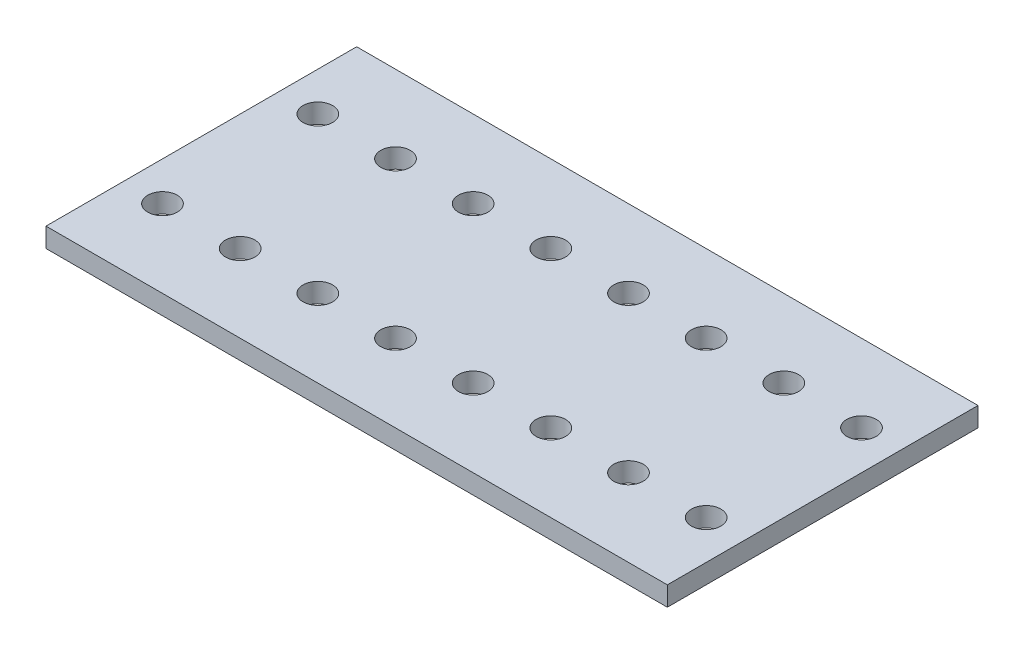
from build123d import *

# Parameters (mm, degrees)
SKETCH1_W           = 101.6
SKETCH1_H           = 50.8
BOSS_EXTRUDE1_DEPTH = 3.175
SKETCH2_R           = 2.413
CUT_EXTRUDE1_DEPTH  = 114.636616568


with BuildPart() as part:
    # Sketch1 → Boss-Extrude1 (new body)
    with BuildSketch(Plane(origin=(0, 0, 0), x_dir=(1, 0, 0), z_dir=(0, 1, 0))):
        with Locations((50.8, 25.4)):
            Rectangle(SKETCH1_W, SKETCH1_H)
    extrude(amount=BOSS_EXTRUDE1_DEPTH)

    # Sketch2 → Cut-Extrude1 (cut, through all)
    with BuildSketch(Plane(origin=(0, 3.175, 0), x_dir=(1, 0, 0), z_dir=(0, 1, 0))):
        with Locations(Location((6.35, 38.1, 0), (0, 0, 270))):
            Circle(SKETCH2_R)
        with Locations(Location((6.35, 12.7, 0), (0, 0, 270))):
            Circle(SKETCH2_R)
        with Locations(Location((19.05, 38.1, 0), (0, 0, 270))):
            Circle(SKETCH2_R)
        with Locations(Location((19.05, 12.7, 0), (0, 0, 270))):
            Circle(SKETCH2_R)
        with Locations(Location((31.75, 38.1, 0), (0, 0, 270))):
            Circle(SKETCH2_R)
        with Locations(Location((31.75, 12.7, 0), (0, 0, 270))):
            Circle(SKETCH2_R)
        with Locations(Location((44.45, 38.1, 0), (0, 0, 270))):
            Circle(SKETCH2_R)
        with Locations(Location((44.45, 12.7, 0), (0, 0, 270))):
            Circle(SKETCH2_R)
        with Locations(Location((57.15, 38.1, 0), (0, 0, 270))):
            Circle(SKETCH2_R)
        with Locations(Location((57.15, 12.7, 0), (0, 0, 270))):
            Circle(SKETCH2_R)
        with Locations(Location((69.85, 38.1, 0), (0, 0, 270))):
            Circle(SKETCH2_R)
        with Locations(Location((69.85, 12.7, 0), (0, 0, 270))):
            Circle(SKETCH2_R)
        with Locations(Location((82.55, 38.1, 0), (0, 0, 270))):
            Circle(SKETCH2_R)
        with Locations(Location((82.55, 12.7, 0), (0, 0, 270))):
            Circle(SKETCH2_R)
        with Locations(Location((95.25, 38.1, 0), (0, 0, 270))):
            Circle(SKETCH2_R)
        with Locations(Location((95.25, 12.7, 0), (0, 0, 270))):
            Circle(SKETCH2_R)
    extrude(amount=-CUT_EXTRUDE1_DEPTH, mode=Mode.SUBTRACT)


solid = part.part
